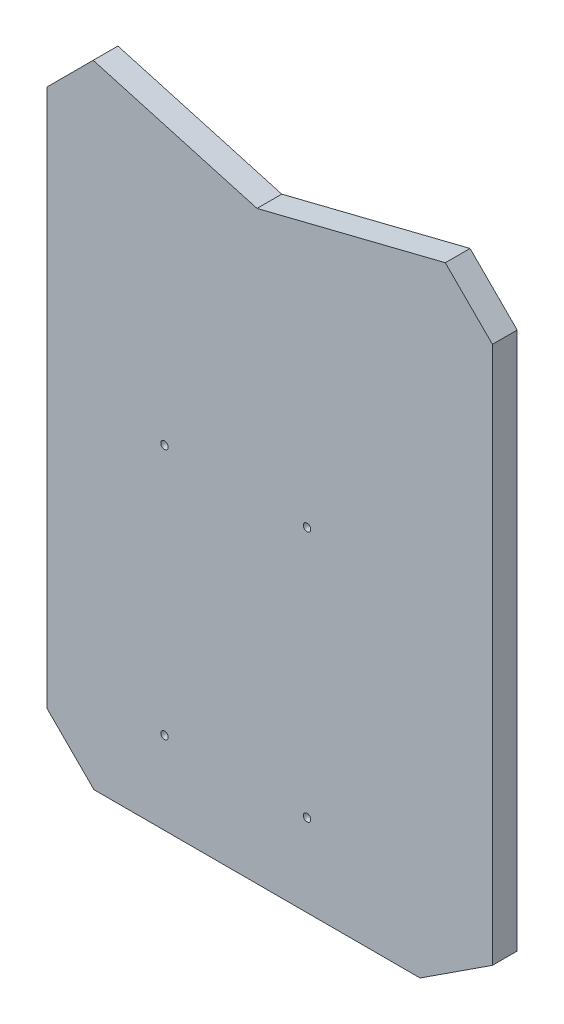
from build123d import *

# Parameters (mm, degrees)
EXTRUDE_2_DEPTH = 10
MM_1_D          = 3


with BuildPart() as part:
    # 草图3 → 凸台-拉伸2 (new body)
    with BuildSketch(Plane.XY):
        Polygon((-276.063392165, 169.449737011), (-276.063392165, -47.876740949), (-257.021298437, -66.918834677), (-125.22188191, -66.918834677), (-95.989685612, -47.876740949), (-95.989685612, 169.449737011), (-101.507171046, 174.967222445), (-115.03177934, 188.491830739), (-191.121590173, 169.449737011), (-257.328922186, 188.18420699), align=None)
    extrude(amount=EXTRUDE_2_DEPTH)

    # 大小mm 暗销孔1 (through all)
    with Locations(Plane(origin=(0, 0, 0), x_dir=(-1, 0, 0), z_dir=(0, 0, -1))):
        with Locations((170.910655251, 67.916631822), (228.522136285, 67.916631822), (228.522136285, -33.616473367), (170.910655251, -33.616473367)):
            Hole(MM_1_D / 2)


solid = part.part
